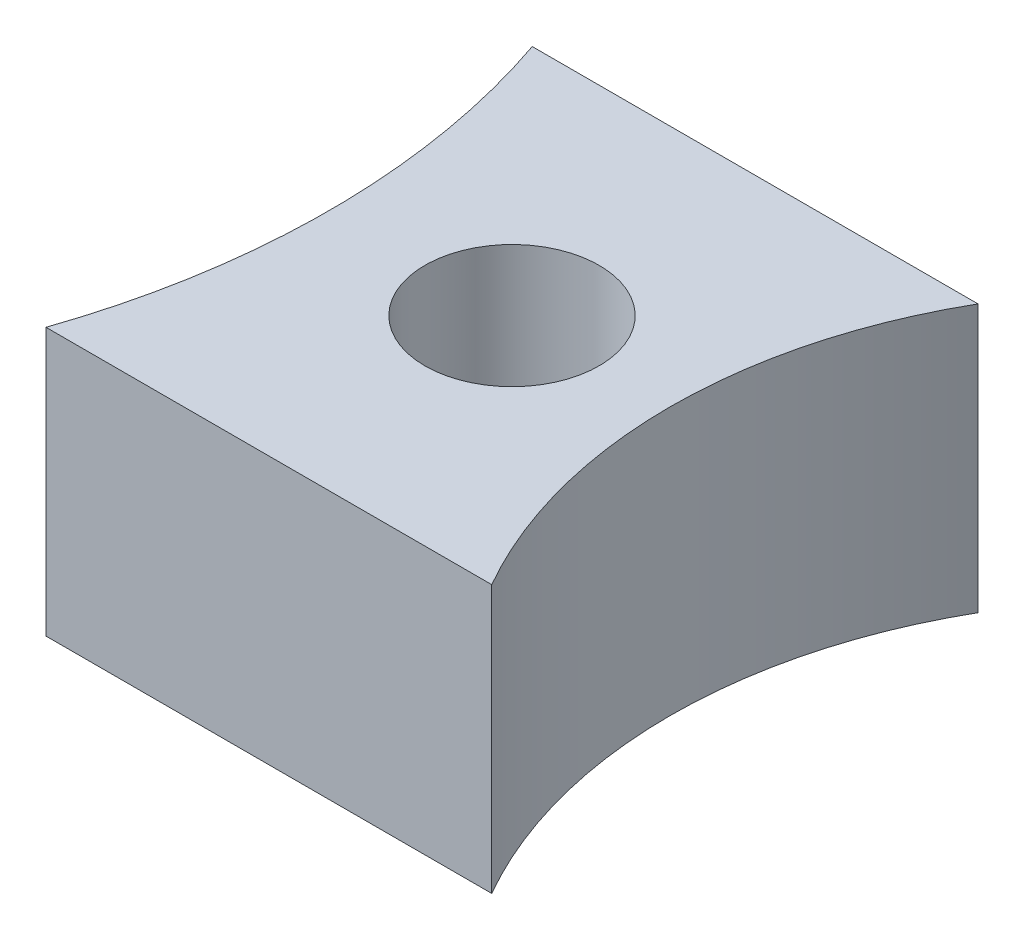
from build123d import *

# Parameters (mm, degrees)
BOSS_EXTRUDE2_DEPTH  = 6.6
M4_CLEARANCE_HOLE2_D = 4.3


with BuildPart() as part:
    # Sketch1 → Boss-Extrude2 (new body)
    with BuildSketch(Plane(origin=(0, 0, 0), x_dir=(1, 0, 0), z_dir=(0, 1, 0))):
        with BuildLine():
            Line((5.5, 6), (-5.5, 6))
            ThreePointArc((-5.5, 6), (-4.751712409, 3.041381265), (-4.5, 0))
            ThreePointArc((-4.5, 0), (-4.751712409, -3.041381265), (-5.5, -6))
            Line((-5.5, -6), (5.5, -6))
            ThreePointArc((5.5, -6), (3.9, 0), (5.5, 6))
        make_face()
    extrude(amount=BOSS_EXTRUDE2_DEPTH)

    # M4 Clearance Hole2 (through all)
    with Locations(Plane(origin=(0, 6.6, 0), x_dir=(1, 0, 0), z_dir=(0, 1, 0))):
        with Locations((0, 0)):
            Hole(M4_CLEARANCE_HOLE2_D / 2)


solid = part.part
